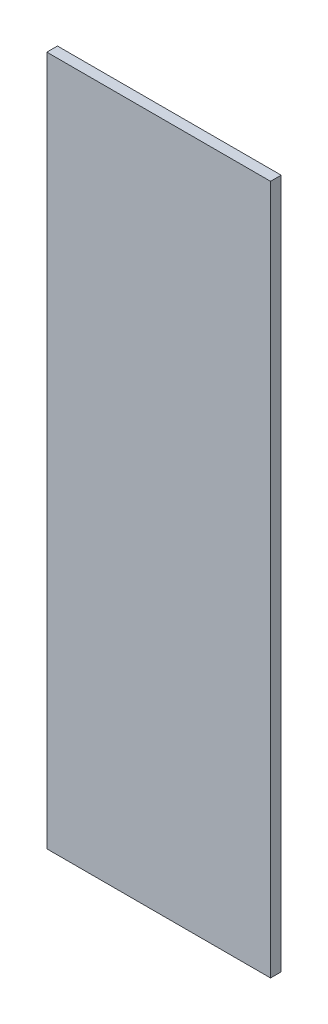
from build123d import *

# Parameters (mm, degrees)
SKETCH1_W           = 535.000000102
SKETCH1_H           = 1650
BOSS_EXTRUDE1_DEPTH = 25.4


with BuildPart() as part:
    # Sketch1 → Boss-Extrude1 (new body)
    with BuildSketch(Plane.XY):
        Rectangle(SKETCH1_W, SKETCH1_H)
    extrude(amount=BOSS_EXTRUDE1_DEPTH)


solid = part.part
